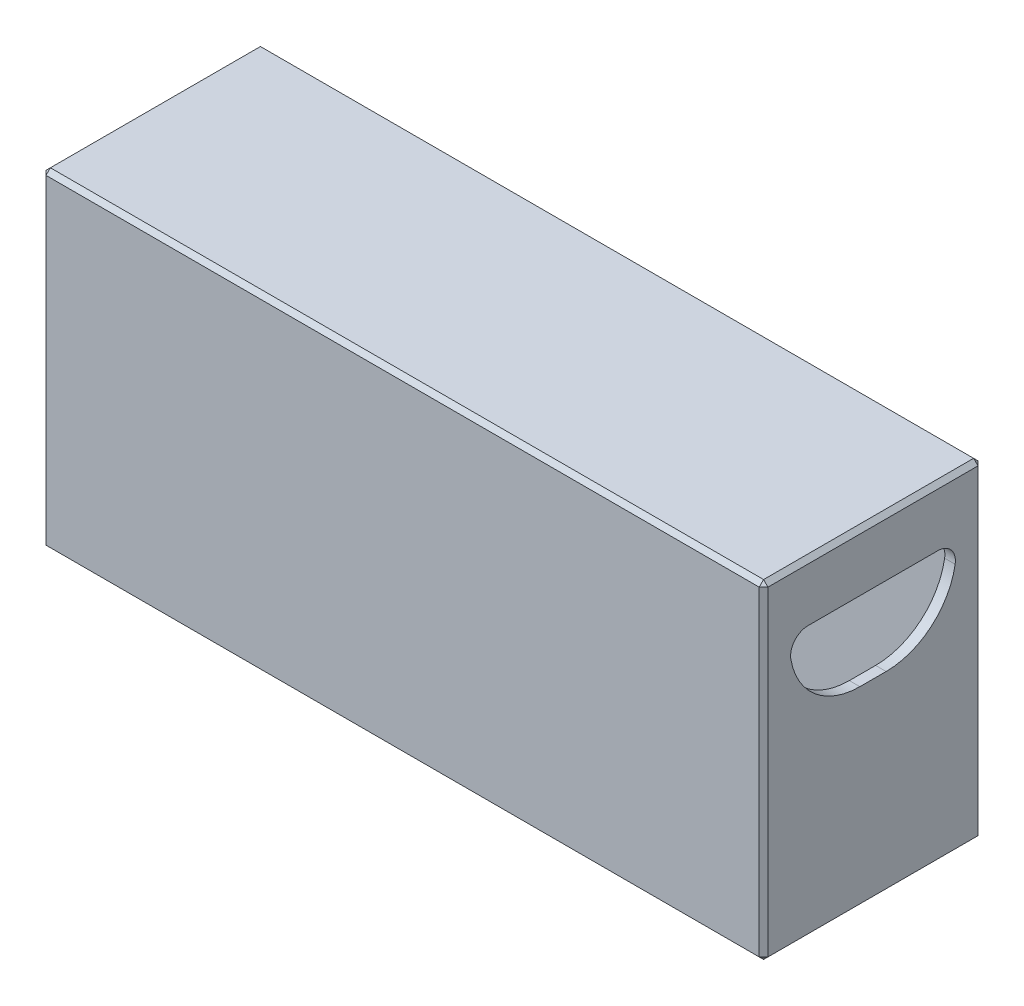
from build123d import *

# Parameters (mm, degrees)
SKETCH1_W           = 82.5
SKETCH1_H           = 25
SKETCH1_W_2         = 80.1
SKETCH1_H_2         = 22.6
BOSS_EXTRUDE1_DEPTH = 23.2
SKETCH1_2_W         = 82.5
SKETCH1_2_H         = 25
BOSS_EXTRUDE2_DEPTH = 2
SKETCH2_W           = 2.5
SKETCH2_H           = 5.55
BOSS_EXTRUDE3_DEPTH = 5
SKETCH8_W           = 82.5
SKETCH8_H           = 25
SKETCH8_W_2         = 80.1
SKETCH8_H_2         = 22.6
BOSS_EXTRUDE4_DEPTH = 11.2
SKETCH10_W          = 82.5
SKETCH10_H          = 25
BOSS_EXTRUDE6_DEPTH = 1.2
SKETCH11_W          = 19
SKETCH11_H          = 9
CUT_EXTRUDE1_DEPTH  = 1.2
FILLET1_R           = 8
FILLET2_R           = 2
CHAMFER1_SIZE       = 0.5
CHAMFER2_SIZE       = 2
SKETCH12_R          = 2
CUT_EXTRUDE2_DEPTH  = 1.2


with BuildPart() as part:
    # Sketch1 → Boss-Extrude1 (new body)
    with BuildSketch(Plane(origin=(0, 0, 0), x_dir=(1, 0, 0), z_dir=(0, 1, 0))):
        Rectangle(SKETCH1_W, SKETCH1_H)
        Rectangle(SKETCH1_W_2, SKETCH1_H_2, mode=Mode.SUBTRACT)
    extrude(amount=BOSS_EXTRUDE1_DEPTH)

    # Sketch1<2> → Boss-Extrude2 (add)
    with BuildSketch(Plane(origin=(0, 0, 0), x_dir=(1, 0, 0), z_dir=(0, 1, 0))):
        Rectangle(SKETCH1_2_W, SKETCH1_2_H)
    extrude(amount=-BOSS_EXTRUDE2_DEPTH)

    # Sketch2 → Boss-Extrude3 (add)
    with BuildSketch(Plane(origin=(0, 0, 0), x_dir=(1, 0, 0), z_dir=(0, 1, 0))):
        with Locations((-38.8, 8.525)):
            Rectangle(SKETCH2_W, SKETCH2_H)
        with Locations((-38.8, -8.525)):
            Rectangle(SKETCH2_W, SKETCH2_H)
        with Locations((38.8, -8.525)):
            Rectangle(SKETCH2_W, SKETCH2_H)
        with Locations((38.8, 8.525)):
            Rectangle(SKETCH2_W, SKETCH2_H)
    extrude(amount=BOSS_EXTRUDE3_DEPTH)

    # Sweep2: sweep along a path in Sketch3
    with BuildLine(Plane(origin=(0, 23.2, 0), x_dir=(1, 0, 0), z_dir=(0, 1, 0))) as sweep2_path:
        Line((-35, 11.3), (35, 11.3))
    # Sketch4 → Sweep2 (sweep)
    with BuildSketch(Plane(origin=(0, 0, 0), x_dir=(0, 0, -1), z_dir=(1, 0, 0))):
        Polygon((10.1, 23.2), (11.3, 24.4), (12.5, 24.4), (12.5, 23.2), align=None)
    sweep2 = sweep(path=sweep2_path.line)

    # Mirror1: Sweep2 across plane
    add(sweep2.mirror(Plane.XY))

    # Sketch8 → Boss-Extrude4 (add)
    with BuildSketch(Plane(origin=(0, 23.2, 0), x_dir=(1, 0, 0), z_dir=(0, 1, 0))):
        Rectangle(SKETCH8_W, SKETCH8_H)
        Rectangle(SKETCH8_W_2, SKETCH8_H_2, mode=Mode.SUBTRACT)
    extrude(amount=BOSS_EXTRUDE4_DEPTH)

    # Sketch10 → Boss-Extrude6 (add)
    with BuildSketch(Plane(origin=(0, 34.4, 0), x_dir=(1, 0, 0), z_dir=(0, 1, 0))):
        Rectangle(SKETCH10_W, SKETCH10_H)
    extrude(amount=BOSS_EXTRUDE6_DEPTH)

    # Sketch11 → Cut-Extrude1 (cut)
    with BuildSketch(Plane(origin=(41.25, 0, 0), x_dir=(0, 0, -1), z_dir=(1, 0, 0))):
        with Locations((0, 24.5)):
            Rectangle(SKETCH11_W, SKETCH11_H)
    extrude(amount=-CUT_EXTRUDE1_DEPTH, mode=Mode.SUBTRACT)

    # Fillet1
    fillet1_edges = [part.edges().sort_by_distance(p)[0] for p in [
        (40.65, 20, -9.5),
        (40.65, 20, 9.5),
    ]]
    fillet(fillet1_edges, radius=FILLET1_R)

    # Fillet2
    fillet2_edges = [part.edges().sort_by_distance(p)[0] for p in [
        (40.65, 29, 9.5),
        (40.65, 29, -9.5),
    ]]
    fillet(fillet2_edges, radius=FILLET2_R)

    # Chamfer1
    chamfer1_edges = [part.edges().sort_by_distance(p)[0] for p in [
        (0, -2, -12.5),
        (41.25, 16.8, -12.5),
        (0, 35.6, -12.5),
        (-41.25, 16.8, -12.5),
        (-41.25, -2, 0),
        (0, -2, 12.5),
        (41.25, -2, 0),
        (41.25, 35.6, 0),
        (41.25, 16.8, 12.5),
        (0, 35.6, 12.5),
        (-41.25, 16.8, 12.5),
        (-41.25, 35.6, 0),
    ]]
    chamfer(chamfer1_edges, length=CHAMFER1_SIZE)

    # Chamfer2
    chamfer2_edges = [part.edges().sort_by_distance(p)[0] for p in [
        (0, 34.4, 11.3),
        (40.05, 34.4, 0),
        (0, 34.4, -11.3),
        (-40.05, 34.4, 0),
    ]]
    chamfer(chamfer2_edges, length=CHAMFER2_SIZE)

    # Sketch12 → Cut-Extrude2 (cut)
    with BuildSketch(Plane.ZY.offset(41.25)):
        with Locations((0, 24)):
            Circle(SKETCH12_R)
    extrude(amount=-CUT_EXTRUDE2_DEPTH, mode=Mode.SUBTRACT)


solid = part.part
